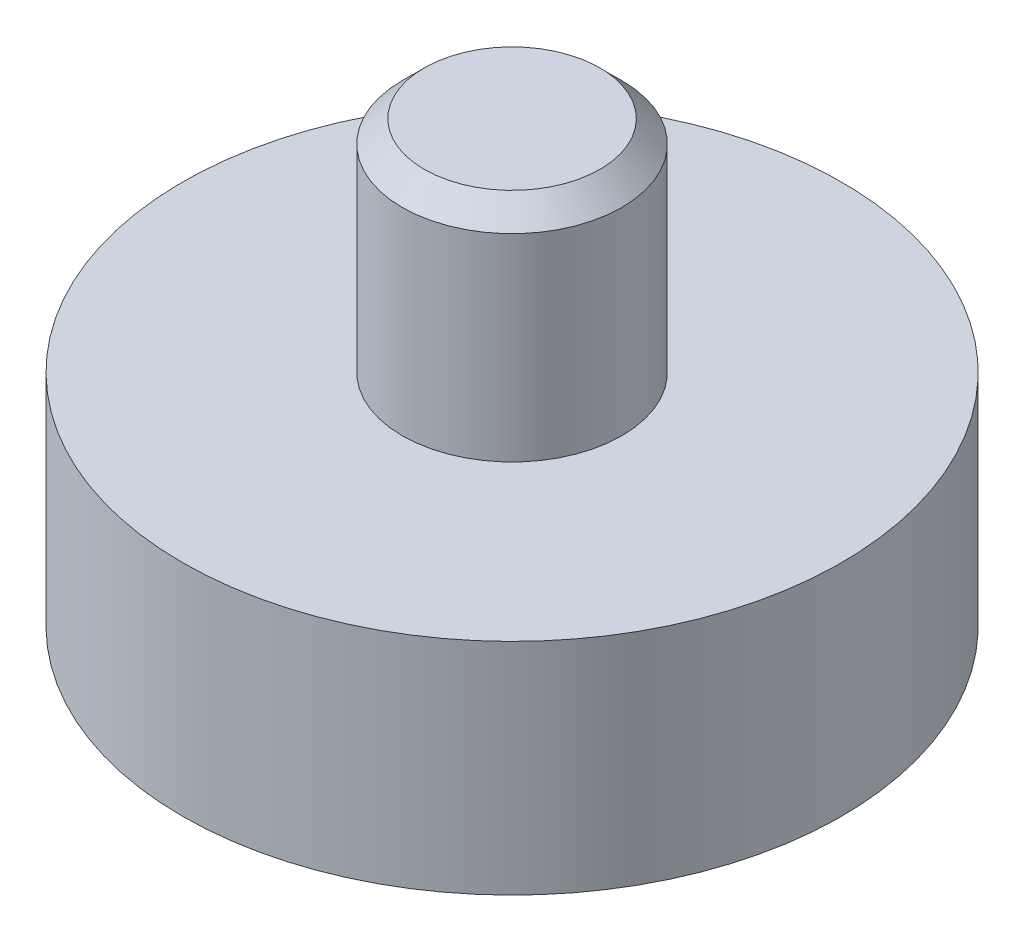
from build123d import *

# Parameters (mm, degrees)
SKETCH1_R           = 15
BOSS_EXTRUDE1_DEPTH = 10
SKETCH2_R           = 5
BOSS_EXTRUDE2_DEPTH = 10
CHAMFER1_SIZE       = 1


with BuildPart() as part:
    # Sketch1 → Boss-Extrude1 (new body)
    with BuildSketch(Plane(origin=(0, 0, 0), x_dir=(1, 0, 0), z_dir=(0, 1, 0))):
        with Locations(Location((-48.851036378, 48.1678051, 0), (0, 0, 270))):
            Circle(SKETCH1_R)
    extrude(amount=BOSS_EXTRUDE1_DEPTH)

    # Sketch2 → Boss-Extrude2 (add)
    with BuildSketch(Plane(origin=(0, 10, 0), x_dir=(1, 0, 0), z_dir=(0, 1, 0))):
        with Locations(Location((-48.851036378, 48.1678051, 0), (0, 0, 270))):
            Circle(SKETCH2_R)
    extrude(amount=BOSS_EXTRUDE2_DEPTH)

    # Chamfer1
    chamfer1_edges = [part.edges().sort_by_distance(p)[0] for p in [
        (-48.851036378, 20, -53.1678051),
    ]]
    chamfer(chamfer1_edges, length=CHAMFER1_SIZE)


solid = part.part
